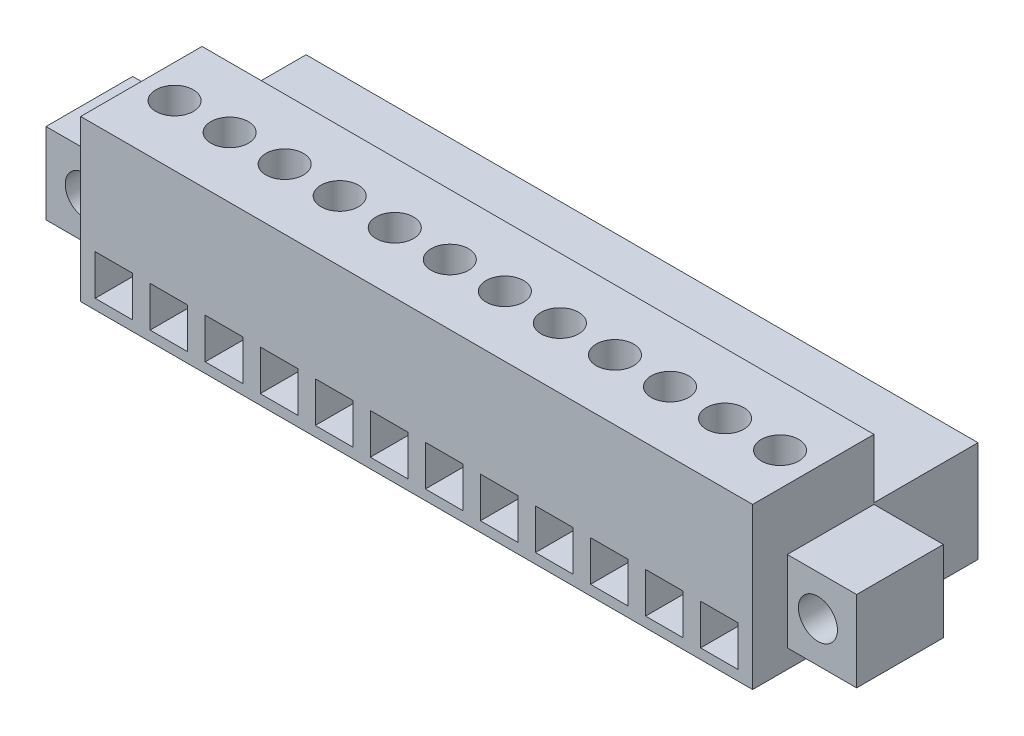
from build123d import *

# Parameters (mm, degrees)
SK_BODY_W                     = 46.51
SK_BODY_H                     = 11.1
BODY_DEPTH                    = 8.4
SK_FLANGE_EARS_W              = 4.8
SK_FLANGE_EARS_H              = 5.6
FLANGE_EARS_DEPTH             = 6
SK_NOSE_W                     = 46.51
SK_NOSE_H                     = 7
NOSE_DEPTH                    = 7.2
FLANGE_SCREW_HOLES_DEPTH      = 32.081232681
FLANGE_SCREW_HOLES_DEPTH_BACK = 32.081232681
SK_FLANGE_SCREW_HOLES_R       = 1.35
SK_WIRE_ENTRIES_W             = 2.6
SK_WIRE_ENTRIES_H             = 2.8
WIRE_ENTRIES_DEPTH            = 6
SK_CONTACT_OPENINGS_W         = 1.6
SK_CONTACT_OPENINGS_H         = 1.6
CONTACT_OPENINGS_DEPTH        = 6.2
SK_CLAMP_SCREW_HOLES_R        = 1.3
CLAMP_SCREW_HOLES_DEPTH       = 3


with BuildPart() as part:
    # SK Body → Body (new body)
    with BuildSketch(Plane.XY.offset(3)):
        with Locations((0, 1.45)):
            Rectangle(SK_BODY_W, SK_BODY_H)
    extrude(amount=BODY_DEPTH)

    # SK Flange ears → Flange ears (add)
    with BuildSketch(Plane.XY.offset(3)):
        with Locations((25.655, 0)):
            Rectangle(SK_FLANGE_EARS_W, SK_FLANGE_EARS_H)
        with Locations((-25.655, 0)):
            Rectangle(SK_FLANGE_EARS_W, SK_FLANGE_EARS_H)
    extrude(amount=FLANGE_EARS_DEPTH)

    # SK Nose → Nose (add)
    with BuildSketch(Plane.XY.offset(3)):
        with Locations((0, -0.6)):
            Rectangle(SK_NOSE_W, SK_NOSE_H)
    extrude(amount=-NOSE_DEPTH)

    # SK Flange screw holes → Flange screw holes (cut, two sides: drawn at the far end of the back side and taken through both)
    with BuildSketch(Plane.XY.offset(-FLANGE_SCREW_HOLES_DEPTH_BACK)):
        with Locations((-25.375, 0)):
            Circle(SK_FLANGE_SCREW_HOLES_R)
        with Locations((25.375, 0)):
            Circle(SK_FLANGE_SCREW_HOLES_R)
    extrude(amount=FLANGE_SCREW_HOLES_DEPTH + FLANGE_SCREW_HOLES_DEPTH_BACK, mode=Mode.SUBTRACT)

    # SK Wire entries → Wire entries (cut)
    with BuildSketch(Plane.XY.offset(11.4)):
        with Locations((-20.955, -2)):
            Rectangle(SK_WIRE_ENTRIES_W, SK_WIRE_ENTRIES_H)
        with Locations((-17.145, -2)):
            Rectangle(SK_WIRE_ENTRIES_W, SK_WIRE_ENTRIES_H)
        with Locations((-13.335, -2)):
            Rectangle(SK_WIRE_ENTRIES_W, SK_WIRE_ENTRIES_H)
        with Locations((-9.525, -2)):
            Rectangle(SK_WIRE_ENTRIES_W, SK_WIRE_ENTRIES_H)
        with Locations((-5.715, -2)):
            Rectangle(SK_WIRE_ENTRIES_W, SK_WIRE_ENTRIES_H)
        with Locations((-1.905, -2)):
            Rectangle(SK_WIRE_ENTRIES_W, SK_WIRE_ENTRIES_H)
        with Locations((1.905, -2)):
            Rectangle(SK_WIRE_ENTRIES_W, SK_WIRE_ENTRIES_H)
        with Locations((5.715, -2)):
            Rectangle(SK_WIRE_ENTRIES_W, SK_WIRE_ENTRIES_H)
        with Locations((9.525, -2)):
            Rectangle(SK_WIRE_ENTRIES_W, SK_WIRE_ENTRIES_H)
        with Locations((13.335, -2)):
            Rectangle(SK_WIRE_ENTRIES_W, SK_WIRE_ENTRIES_H)
        with Locations((17.145, -2)):
            Rectangle(SK_WIRE_ENTRIES_W, SK_WIRE_ENTRIES_H)
        with Locations((20.955, -2)):
            Rectangle(SK_WIRE_ENTRIES_W, SK_WIRE_ENTRIES_H)
    extrude(amount=-WIRE_ENTRIES_DEPTH, mode=Mode.SUBTRACT)

    # SK Contact openings → Contact openings (cut)
    with BuildSketch(Plane.XY.offset(-4.2)):
        with Locations((-20.955, -0.6)):
            Rectangle(SK_CONTACT_OPENINGS_W, SK_CONTACT_OPENINGS_H)
        with Locations((-17.145, -0.6)):
            Rectangle(SK_CONTACT_OPENINGS_W, SK_CONTACT_OPENINGS_H)
        with Locations((-13.335, -0.6)):
            Rectangle(SK_CONTACT_OPENINGS_W, SK_CONTACT_OPENINGS_H)
        with Locations((-9.525, -0.6)):
            Rectangle(SK_CONTACT_OPENINGS_W, SK_CONTACT_OPENINGS_H)
        with Locations((-5.715, -0.6)):
            Rectangle(SK_CONTACT_OPENINGS_W, SK_CONTACT_OPENINGS_H)
        with Locations((-1.905, -0.6)):
            Rectangle(SK_CONTACT_OPENINGS_W, SK_CONTACT_OPENINGS_H)
        with Locations((1.905, -0.6)):
            Rectangle(SK_CONTACT_OPENINGS_W, SK_CONTACT_OPENINGS_H)
        with Locations((5.715, -0.6)):
            Rectangle(SK_CONTACT_OPENINGS_W, SK_CONTACT_OPENINGS_H)
        with Locations((9.525, -0.6)):
            Rectangle(SK_CONTACT_OPENINGS_W, SK_CONTACT_OPENINGS_H)
        with Locations((13.335, -0.6)):
            Rectangle(SK_CONTACT_OPENINGS_W, SK_CONTACT_OPENINGS_H)
        with Locations((17.145, -0.6)):
            Rectangle(SK_CONTACT_OPENINGS_W, SK_CONTACT_OPENINGS_H)
        with Locations((20.955, -0.6)):
            Rectangle(SK_CONTACT_OPENINGS_W, SK_CONTACT_OPENINGS_H)
    extrude(amount=CONTACT_OPENINGS_DEPTH, mode=Mode.SUBTRACT)

    # SK Clamp screw holes → Clamp screw holes (cut)
    with BuildSketch(Plane(origin=(0, 7, 0), x_dir=(1, 0, 0), z_dir=(0, 1, 0))):
        with Locations(Location((-20.955, -7.2, 0), (0, 0, 270))):
            Circle(SK_CLAMP_SCREW_HOLES_R)
        with Locations(Location((-17.145, -7.2, 0), (0, 0, 270))):
            Circle(SK_CLAMP_SCREW_HOLES_R)
        with Locations(Location((-13.335, -7.2, 0), (0, 0, 270))):
            Circle(SK_CLAMP_SCREW_HOLES_R)
        with Locations(Location((-9.525, -7.2, 0), (0, 0, 270))):
            Circle(SK_CLAMP_SCREW_HOLES_R)
        with Locations(Location((-5.715, -7.2, 0), (0, 0, 270))):
            Circle(SK_CLAMP_SCREW_HOLES_R)
        with Locations(Location((-1.905, -7.2, 0), (0, 0, 270))):
            Circle(SK_CLAMP_SCREW_HOLES_R)
        with Locations(Location((1.905, -7.2, 0), (0, 0, 270))):
            Circle(SK_CLAMP_SCREW_HOLES_R)
        with Locations(Location((5.715, -7.2, 0), (0, 0, 270))):
            Circle(SK_CLAMP_SCREW_HOLES_R)
        with Locations(Location((9.525, -7.2, 0), (0, 0, 270))):
            Circle(SK_CLAMP_SCREW_HOLES_R)
        with Locations(Location((13.335, -7.2, 0), (0, 0, 270))):
            Circle(SK_CLAMP_SCREW_HOLES_R)
        with Locations(Location((17.145, -7.2, 0), (0, 0, 270))):
            Circle(SK_CLAMP_SCREW_HOLES_R)
        with Locations(Location((20.955, -7.2, 0), (0, 0, 270))):
            Circle(SK_CLAMP_SCREW_HOLES_R)
    extrude(amount=-CLAMP_SCREW_HOLES_DEPTH, mode=Mode.SUBTRACT)


solid = part.part
